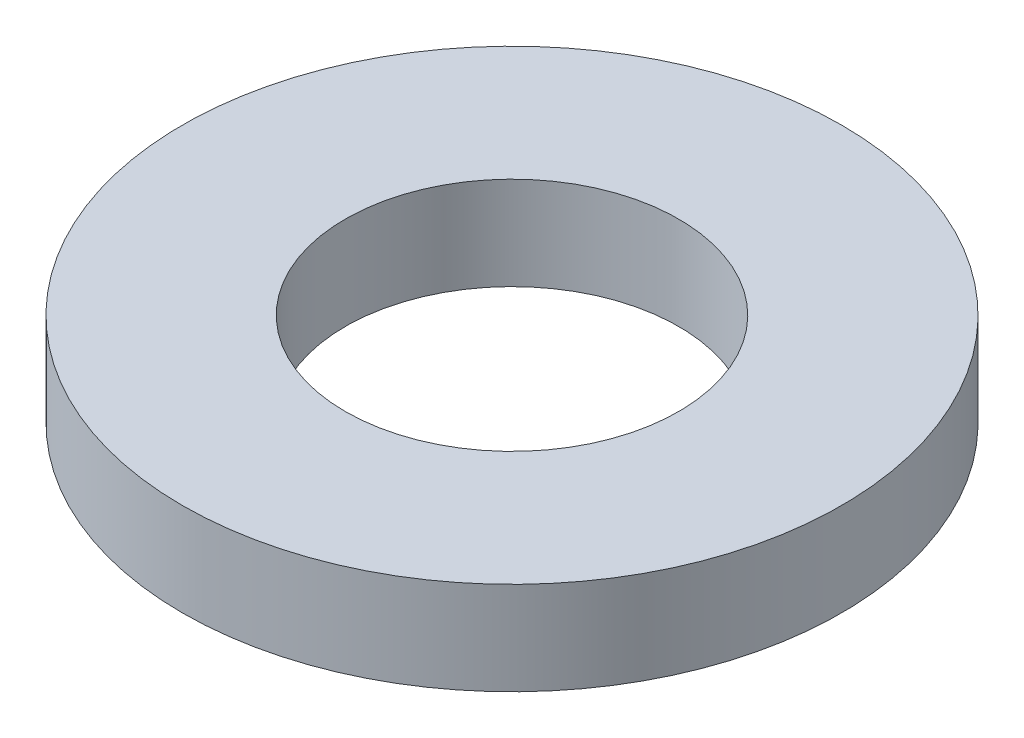
from build123d import *

# Parameters (mm, degrees)
SKETCH_1_R      = 4.25
SKETCH_1_R_2    = 2.15
EXTRUDE_1_DEPTH = 1.2


with BuildPart() as part:
    # 草图1 → 凸台-拉伸1 (new body)
    with BuildSketch(Plane(origin=(0, 0, 0), x_dir=(1, 0, 0), z_dir=(0, 1, 0))):
        with Locations(Location((0, 0, 0), (0, 0, 270))):
            Circle(SKETCH_1_R)
        with Locations(Location((0, 0, 0), (0, 0, 270))):
            Circle(SKETCH_1_R_2, mode=Mode.SUBTRACT)
    extrude(amount=EXTRUDE_1_DEPTH)


solid = part.part
